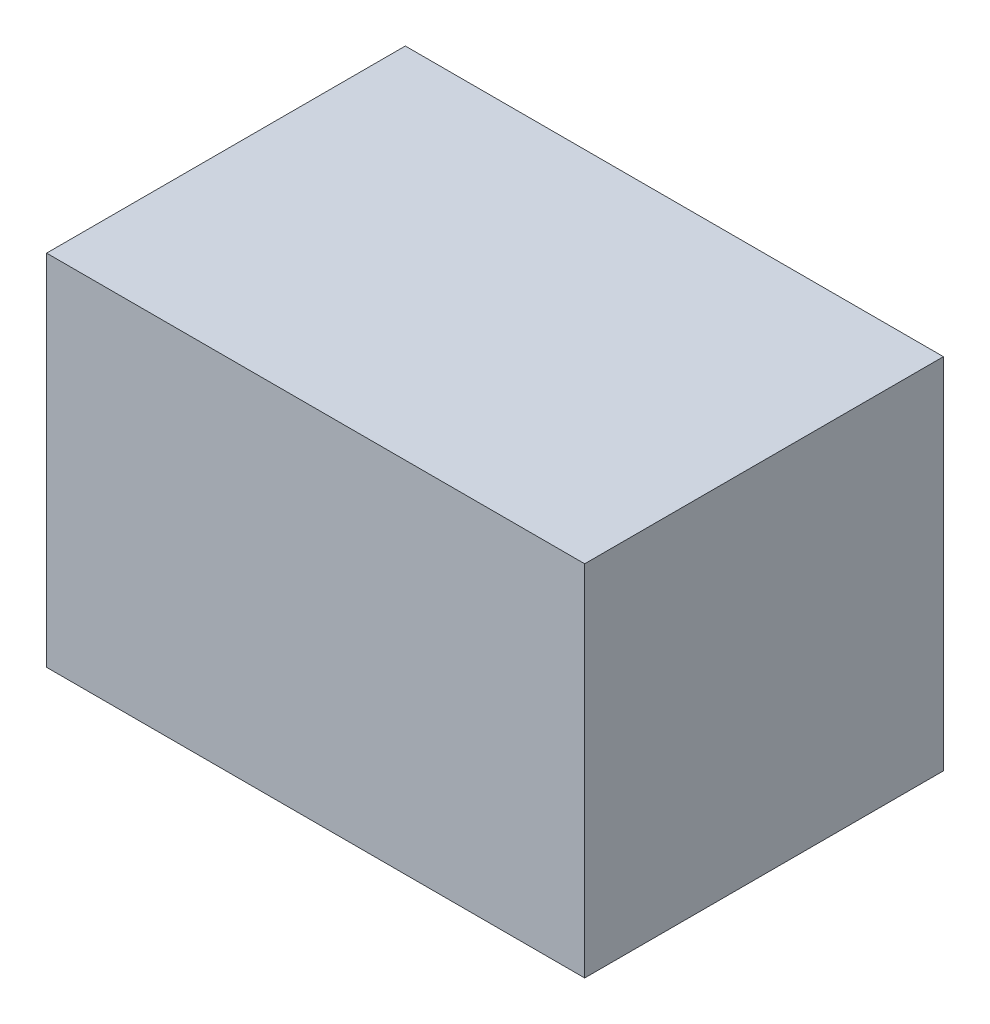
from build123d import *

# Parameters (mm, degrees)
PACK_KAPAK_SWITCH_2_1_START = -620
SKETCH1_W                   = 30
SKETCH1_H                   = 20
PACK_KAPAK_SWITCH_2_1_DEPTH = 20


with BuildPart() as part:
    # Sketch1 → PACK_kapak_switch_2_1 (new body)
    with BuildSketch(Plane.XY.offset(PACK_KAPAK_SWITCH_2_1_START)):
        with Locations((565, 910)):
            Rectangle(SKETCH1_W, SKETCH1_H)
    extrude(amount=-PACK_KAPAK_SWITCH_2_1_DEPTH)


solid = part.part
